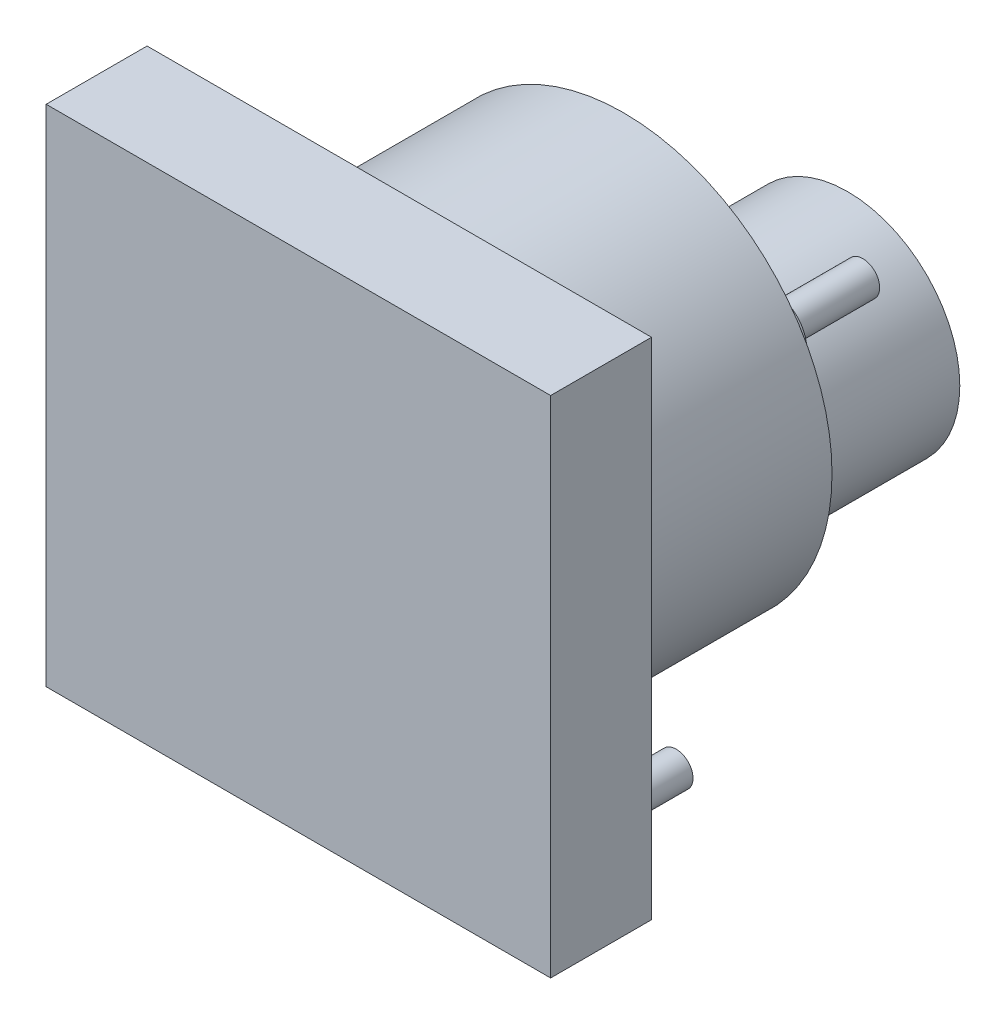
from build123d import *

# Parameters (mm, degrees)
SKETCH_1_W      = 45
SKETCH_1_H      = 45
EXTRUDE_1_DEPTH = 9
SKETCH_2_R      = 18.6
EXTRUDE_2_DEPTH = 20
SKETCH_3_R      = 3
EXTRUDE_3_DEPTH = 2
SKETCH_4_R      = 1.5
EXTRUDE_4_DEPTH = 8
SKETCH_5_R      = 10
EXTRUDE_5_DEPTH = 20
SKETCH_6_R      = 1.5
EXTRUDE_6_DEPTH = 7.6


with BuildPart() as part:
    # 草图1 → 凸台-拉伸1 (new body)
    with BuildSketch(Plane.XY):
        with Locations((22.5, 22.5)):
            Rectangle(SKETCH_1_W, SKETCH_1_H)
    extrude(amount=-EXTRUDE_1_DEPTH)

    # 草图2 → 凸台-拉伸2 (add)
    with BuildSketch(Plane(origin=(0, 0, -9), x_dir=(-1, 0, 0), z_dir=(0, 0, -1))):
        with Locations((-22.5, 22.5)):
            Circle(SKETCH_2_R)
    extrude(amount=EXTRUDE_2_DEPTH)

    # 草图3 → 凸台-拉伸3 (add)
    with BuildSketch(Plane(origin=(0, 0, -29), x_dir=(-1, 0, 0), z_dir=(0, 0, -1))):
        with Locations((-33.85, 29)):
            Circle(SKETCH_3_R)
        with Locations((-11.15, 29)):
            Circle(SKETCH_3_R)
    extrude(amount=EXTRUDE_3_DEPTH)

    # 草图4 → 凸台-拉伸4 (add)
    with BuildSketch(Plane(origin=(0, 0, -31), x_dir=(-1, 0, 0), z_dir=(0, 0, -1))):
        with Locations((-33.85, 29)):
            Circle(SKETCH_4_R)
        with Locations((-11.15, 29)):
            Circle(SKETCH_4_R)
    extrude(amount=EXTRUDE_4_DEPTH)

    # 草图5 → 凸台-拉伸5 (add)
    with BuildSketch(Plane(origin=(0, 0, -29), x_dir=(-1, 0, 0), z_dir=(0, 0, -1))):
        with Locations((-22.5, 15)):
            Circle(SKETCH_5_R)
    extrude(amount=EXTRUDE_5_DEPTH)

    # 草图6 → 凸台-拉伸6 (add)
    with BuildSketch(Plane(origin=(0, 0, -9), x_dir=(-1, 0, 0), z_dir=(0, 0, -1))):
        with Locations(Location((-39.6, 5.18, 0), (0, 0, 180))):
            Circle(SKETCH_6_R)
        with Locations(Location((-5.4, 5.18, 0), (0, 0, 180))):
            Circle(SKETCH_6_R)
    extrude(amount=EXTRUDE_6_DEPTH)


solid = part.part
